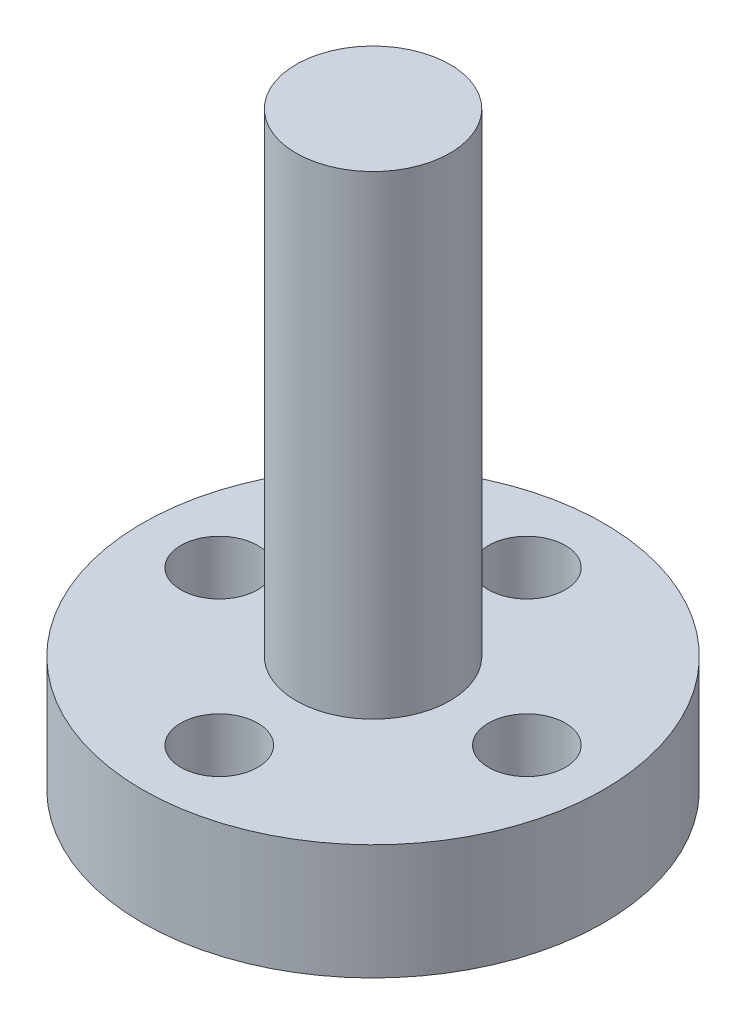
from build123d import *

# Parameters (mm, degrees)
SKETCH_1_R          = 9
EXTRUDE_1_DEPTH     = 4.5
SKETCH_2_R          = 2
CUT_EXTRUDE_1_DEPTH = 2
SKETCH_3_R          = 1.5
CUT_EXTRUDE_2_DEPTH = 14.5
SKETCH_4_R          = 3
EXTRUDE_2_DEPTH     = 18.5


with BuildPart() as part:
    # 草图1 → 凸台-拉伸1 (new body)
    with BuildSketch(Plane(origin=(0, 0, 0), x_dir=(1, 0, 0), z_dir=(0, 1, 0))):
        with Locations(Location((0, 0, 0), (0, 0, 270))):
            Circle(SKETCH_1_R)
    extrude(amount=EXTRUDE_1_DEPTH)

    # 草图2 → 切除-拉伸1 (cut)
    with BuildSketch(Plane.XZ):
        with Locations(Location((0, 0, 0), (0, 0, 270))):
            Circle(SKETCH_2_R)
    extrude(amount=-CUT_EXTRUDE_1_DEPTH, mode=Mode.SUBTRACT)

    # 草图3 → 切除-拉伸2 (cut, through all)
    with BuildSketch(Plane.XZ):
        with Locations(Location((0, 6, 0), (0, 0, 270))):
            Circle(SKETCH_3_R)
        with Locations(Location((6, 0, 0), (0, 0, 270))):
            Circle(SKETCH_3_R)
        with Locations(Location((0, -6, 0), (0, 0, 270))):
            Circle(SKETCH_3_R)
        with Locations(Location((-6, 0, 0), (0, 0, 270))):
            Circle(SKETCH_3_R)
    extrude(amount=-CUT_EXTRUDE_2_DEPTH, mode=Mode.SUBTRACT)

    # 草图4 → 凸台-拉伸2 (add)
    with BuildSketch(Plane(origin=(0, 4.5, 0), x_dir=(1, 0, 0), z_dir=(0, 1, 0))):
        with Locations(Location((0, 0, 0), (0, 0, 270))):
            Circle(SKETCH_4_R)
    extrude(amount=EXTRUDE_2_DEPTH)


solid = part.part
